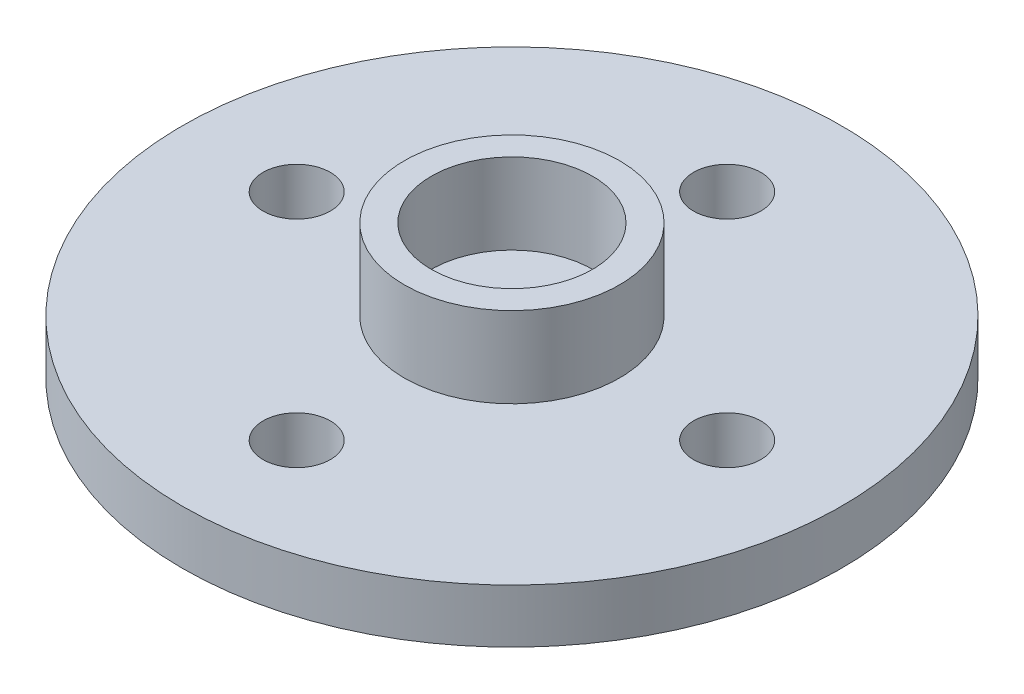
from build123d import *

# Parameters (mm, degrees)
SKETCH_1_R          = 12.25
EXTRUDE_1_DEPTH     = 2
SKETCH_2_R          = 4
EXTRUDE_2_DEPTH     = 3
SKETCH_3_R          = 1.25
CUT_EXTRUDE_1_DEPTH = 3
SKETCH_4_R          = 3
CUT_EXTRUDE_2_DEPTH = 3


with BuildPart() as part:
    # 草图1 → 凸台-拉伸1 (new body)
    with BuildSketch(Plane(origin=(0, 0, 0), x_dir=(1, 0, 0), z_dir=(0, 1, 0))):
        with Locations(Location((0, 0, 0), (0, 0, 270))):
            Circle(SKETCH_1_R)
    extrude(amount=EXTRUDE_1_DEPTH)

    # 草图2 → 凸台-拉伸2 (add)
    with BuildSketch(Plane(origin=(0, 2, 0), x_dir=(1, 0, 0), z_dir=(0, 1, 0))):
        with Locations(Location((0, 0, 0), (0, 0, 270))):
            Circle(SKETCH_2_R)
    extrude(amount=EXTRUDE_2_DEPTH)

    # 草图3 → 切除-拉伸1 (cut)
    with BuildSketch(Plane(origin=(0, 2, 0), x_dir=(1, 0, 0), z_dir=(0, 1, 0))):
        with Locations(Location((-8, 0, 0), (0, 0, 270))):
            Circle(SKETCH_3_R)
        with Locations(Location((0, 8, 0), (0, 0, 270))):
            Circle(SKETCH_3_R)
        with Locations(Location((8, 0, 0), (0, 0, 270))):
            Circle(SKETCH_3_R)
        with Locations(Location((0, -8, 0), (0, 0, 270))):
            Circle(SKETCH_3_R)
    extrude(amount=-CUT_EXTRUDE_1_DEPTH, mode=Mode.SUBTRACT)

    # 草图4 → 切除-拉伸2 (cut)
    with BuildSketch(Plane(origin=(0, 5, 0), x_dir=(1, 0, 0), z_dir=(0, 1, 0))):
        with Locations(Location((0, 0, 0), (0, 0, 270))):
            Circle(SKETCH_4_R)
    extrude(amount=-CUT_EXTRUDE_2_DEPTH, mode=Mode.SUBTRACT)


solid = part.part
